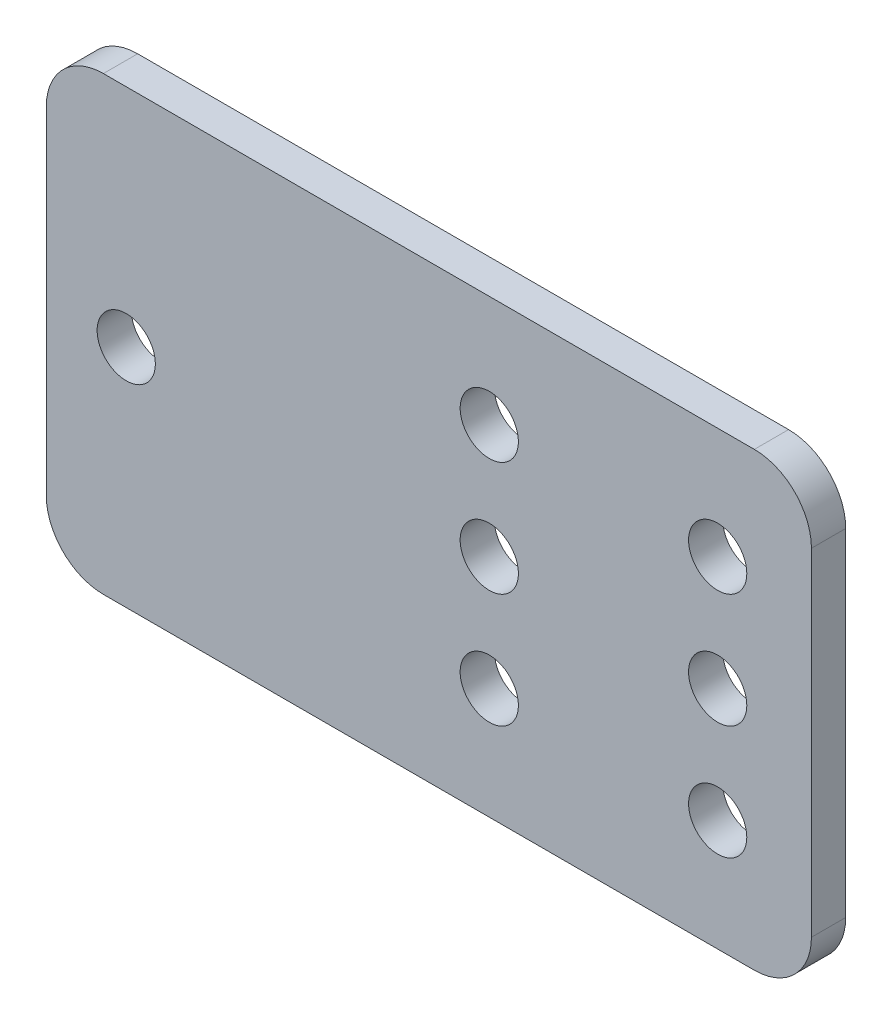
from build123d import *

# Parameters (mm, degrees)
ESQUISSE1_R        = 2.55
BOSS_EXTRU_1_DEPTH = 1.5


with BuildPart() as part:
    # Esquisse1 → Boss.-Extru.1 (new, symmetric)
    with BuildSketch(Plane.XY):
        with BuildLine():
            Line((-28.5, -19.75), (28.5, -19.75))
            ThreePointArc((28.5, -19.75), (32.035533906, -18.285533906), (33.5, -14.75))
            Line((33.5, -14.75), (33.5, 14.75))
            ThreePointArc((33.5, 14.75), (32.035533906, 18.285533906), (28.5, 19.75))
            Line((28.5, 19.75), (-28.5, 19.75))
            ThreePointArc((-28.5, 19.75), (-32.035533906, 18.285533906), (-33.5, 14.75))
            Line((-33.5, 14.75), (-33.5, -14.75))
            ThreePointArc((-33.5, -14.75), (-32.035533906, -18.285533906), (-28.5, -19.75))
        make_face()
        with Locations((5.29, 10)):
            Circle(ESQUISSE1_R, mode=Mode.SUBTRACT)
        with Locations((25.29, 10)):
            Circle(ESQUISSE1_R, mode=Mode.SUBTRACT)
        with Locations((5.29, 0)):
            Circle(ESQUISSE1_R, mode=Mode.SUBTRACT)
        with Locations((25.29, 0)):
            Circle(ESQUISSE1_R, mode=Mode.SUBTRACT)
        with Locations((5.29, -10)):
            Circle(ESQUISSE1_R, mode=Mode.SUBTRACT)
        with Locations((25.29, -10)):
            Circle(ESQUISSE1_R, mode=Mode.SUBTRACT)
        with Locations((-26.5, 0)):
            Circle(ESQUISSE1_R, mode=Mode.SUBTRACT)
    extrude(amount=BOSS_EXTRU_1_DEPTH, both=True)


solid = part.part
